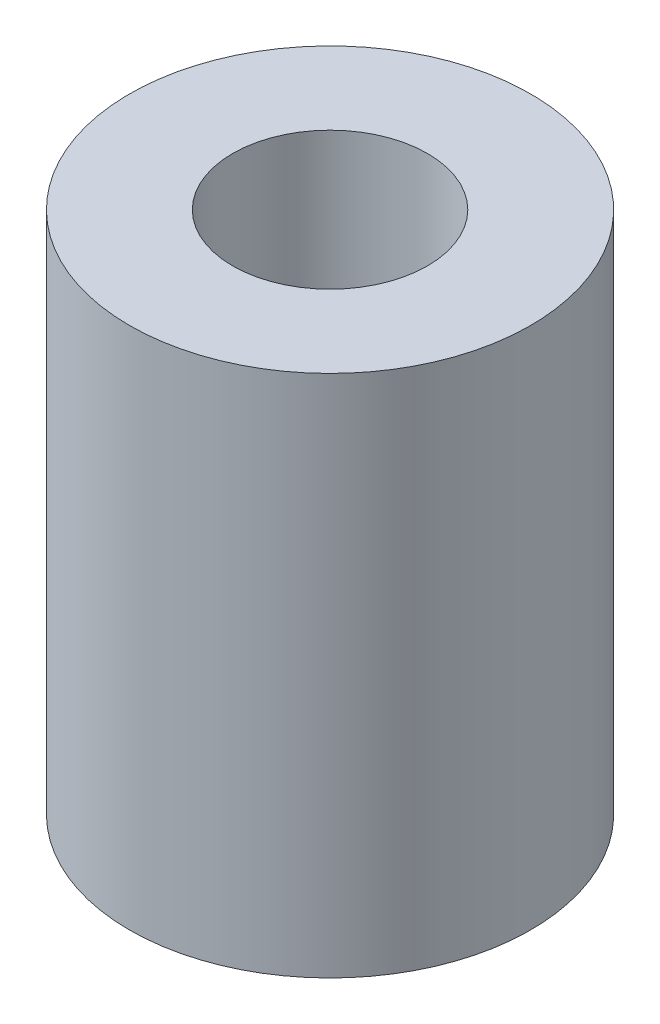
from build123d import *

# Parameters (mm, degrees)
SKETCH1_R           = 3.5
SKETCH1_R_2         = 1.7
BOSS_EXTRUDE1_DEPTH = 9.137


with BuildPart() as part:
    # Sketch1 → Boss-Extrude1 (new body)
    with BuildSketch(Plane(origin=(0, 0, 0), x_dir=(1, 0, 0), z_dir=(0, 1, 0))):
        with Locations(Location((0, 0, 0), (0, 0, 270))):
            Circle(SKETCH1_R)
        with Locations(Location((0, 0, 0), (0, 0, 270))):
            Circle(SKETCH1_R_2, mode=Mode.SUBTRACT)
    extrude(amount=BOSS_EXTRUDE1_DEPTH)


solid = part.part
